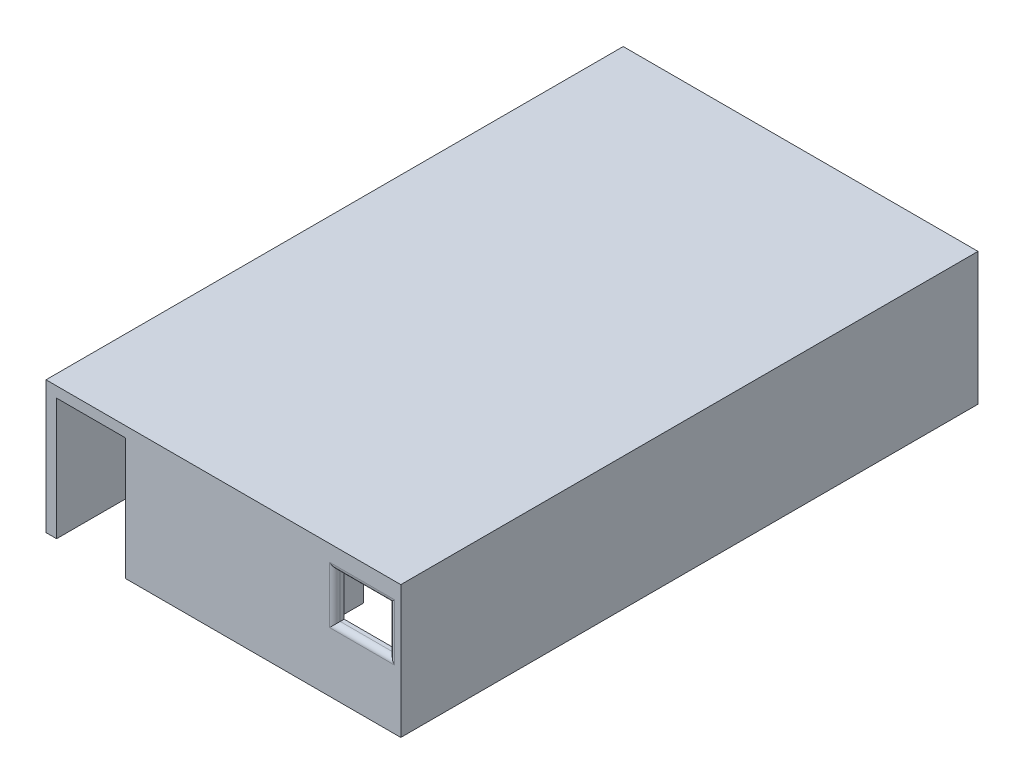
from build123d import *

# Parameters (mm, degrees)
BOSS_EXTRUDE1_DEPTH         = 29
SKETCH3_W                   = 4.5
SKETCH3_H                   = 21
CUT_EXTRUDE1_DEPTH          = 6
SKETCH6_R                   = 2.15
CUT_EXTRUDE2_DEPTH          = 41.509258201
CUT_EXTRUDE3_DEPTH          = 3.5
EXTRUDE_1_REACH             = 41.674
SKETCH_1_W                  = 19.5
SKETCH_1_H                  = 14.5
EXTRUDE_1_DIRECTION_2_REACH = 41.674
SKETCH_2_W                  = 4.5
SKETCH_2_H                  = 1
CUT_EXTRUDE_1_DEPTH         = 19.5
SKETCH_4_W                  = 4
SKETCH_4_H                  = 4
CUT_EXTRUDE_3_DEPTH         = 0.7
SKETCH_5_W                  = 2
SKETCH_5_H                  = 12
CUT_EXTRUDE_4_DEPTH         = 6.25
SKETCH_6_W                  = 11
SKETCH_6_H                  = 11
CUT_EXTRUDE_5_DEPTH         = 6.25
SKETCH_7_W                  = 10.248534494
SKETCH_7_H                  = 8.686096419
CUT_EXTRUDE_6_DEPTH         = 1.75
SKETCH_8_W                  = 2
SKETCH_8_H                  = 14.5
EXTRUDE_2_DEPTH             = 10
SKETCH_9_W                  = 2
SKETCH_9_H                  = 14.5
EXTRUDE_3_DEPTH             = 7.5
FILLET_1_R                  = 1
CUT_EXTRUDE_7_DEPTH         = 41.509258201
CUT_EXTRUDE_7_DEPTH_BACK    = 41.509258201
SKETCH_10_W                 = 65.54105611
SKETCH_10_H                 = 22.030016429
CUT_EXTRUDE_8_DEPTH         = 47.588625221
CUT_EXTRUDE_8_DEPTH_BACK    = 47.588625221
SKETCH_11_W                 = 33.086172565
SKETCH_11_H                 = 28.836254029
SKETCH_12_W                 = 67
SKETCH_12_H                 = 109
EXTRUDE_4_DEPTH             = 2
EXTRUDE_3_2_DEPTH           = 25
SKETCH_13_3_W               = 33
SKETCH_13_3_H               = 2
SKETCH_13_3_W_2             = 2
SKETCH_13_3_H_2             = 94
EXTRUDE_4_2_DEPTH           = 25
EXTRUDE_5_DEPTH             = 10.5
EXTRUDE_5_2_DEPTH           = 2


with BuildPart() as part:
    # Sketch2 → Boss-Extrude1 (new body)
    with BuildSketch(Plane(origin=(0, 0, 0), x_dir=(1, 0, 0), z_dir=(0, 1, 0))):
        with BuildLine():
            Line((0, 10), (0, 20))
            Line((0, 20), (8, 20))
            Line((8, 20), (8, 14.245191882))
            ThreePointArc((8, 14.245191882), (10.672752557, 14.316274399), (13, 13))
            Line((13, 13), (9.464466094, 9.464466094))
            Line((9.464466094, 9.464466094), (2.928932188, 2.928932188))
            ThreePointArc((2.928932188, 2.928932188), (0.761204675, 6.173165676), (0, 10))
        make_face()
    boss_extrude1 = extrude(amount=BOSS_EXTRUDE1_DEPTH)

    # Mirror1: Boss-Extrude1 across plane
    add(boss_extrude1.mirror(Plane(origin=(0, 0, 0), x_dir=(-0.707106781186546, 0, 0.707106781186549), z_dir=(0.707106781186549, 0, 0.707106781186546))))

    # Sketch3 → Cut-Extrude1 (cut)
    with BuildSketch(Plane(origin=(0, 0, -20), x_dir=(-1, 0, 0), z_dir=(0, 0, -1))):
        with Locations((-4, 14.5)):
            Rectangle(SKETCH3_W, SKETCH3_H)
    cut_extrude1 = extrude(amount=-CUT_EXTRUDE1_DEPTH, mode=Mode.SUBTRACT)

    # Mirror2: Cut-Extrude1 across plane
    add(cut_extrude1.mirror(Plane(origin=(0, 0, 0), x_dir=(-0.707106781186546, 0, 0.707106781186549), z_dir=(0.707106781186549, 0, 0.707106781186546))), mode=Mode.SUBTRACT)

    # Sketch6 → Cut-Extrude2 (cut, through all)
    with BuildSketch(Plane(origin=(0, 29, 0), x_dir=(1, 0, 0), z_dir=(0, 1, 0))):
        with Locations(Location((10, 10, 0), (0, 0, 270))):
            Circle(SKETCH6_R)
    extrude(amount=-CUT_EXTRUDE2_DEPTH, mode=Mode.SUBTRACT)

    # Sketch9 → Cut-Extrude3 (cut)
    with BuildSketch(Plane(origin=(0, 24, 0), x_dir=(1, 0, 0), z_dir=(0, 1, 0))):
        Polygon((8.939052358, 13.959510504), (13.429036683, 18.44949483), (18.429313529, 13.762345089), (13.959510504, 8.939052358), (11.060947642, 6.040489496), (7.101437138, 7.101437138), (6.040489496, 11.060947642), align=None)
    cut_extrude3 = extrude(amount=-CUT_EXTRUDE3_DEPTH, mode=Mode.SUBTRACT)

    # Mirror4: Cut-Extrude3 across plane
    add(cut_extrude3.mirror(Plane.ZX.offset(14.5)), mode=Mode.SUBTRACT)


with BuildPart() as body_2:

    # Бобышка-Вытянуть1: up to this face of the body (flat: up to its plane)
    extrude_1_end = Plane(part.part.faces().sort_by_distance((17.122595941, 14.5, -8))[0])
    # Эскиз1 → Бобышка-Вытянуть1 (new, up to the picked face)
    with BuildSketch(Plane(origin=(0, 0, -1.75), x_dir=(-1, 0, 0), z_dir=(0, 0, -1)), mode=Mode.PRIVATE) as extrude_1_sk1:
        with Locations((-29.75, 7.25)):
            Rectangle(SKETCH_1_W, SKETCH_1_H)
    extrude_1_tool1 = split(extrude(extrude_1_sk1.sketch, amount=EXTRUDE_1_REACH, mode=Mode.PRIVATE), bisect_by=extrude_1_end, keep=Keep.BOTH, mode=Mode.PRIVATE)
    add(extrude_1_tool1.solids().sort_by(Axis((29.75, 7.25, -1.75), (0, 0, -1)))[0])


    # Бобышка-Вытянуть1 direction 2: up to this face of the body (flat: up to its plane)
    extrude_1_direction_2_end = Plane(part.part.faces().sort_by_distance((15, 14.5, 0))[0])
    # Эскиз1 → Бобышка-Вытянуть1 direction 2 (add, up to the picked face)
    with BuildSketch(Plane(origin=(0, 0, -1.75), x_dir=(-1, 0, 0), z_dir=(0, 0, -1)), mode=Mode.PRIVATE) as extrude_1_direction_2_sk1:
        with Locations((-29.75, 7.25)):
            Rectangle(SKETCH_1_W, SKETCH_1_H)
    extrude_1_direction_2_tool1 = split(extrude(extrude_1_direction_2_sk1.sketch, amount=-EXTRUDE_1_DIRECTION_2_REACH, mode=Mode.PRIVATE), bisect_by=extrude_1_direction_2_end, keep=Keep.BOTH, mode=Mode.PRIVATE)
    add(extrude_1_direction_2_tool1.solids().sort_by(Axis((29.75, 7.25, -1.75), (0, 0, 1)))[0])

    # Эскиз2 → Вырез-Вытянуть1 (cut)
    with BuildSketch(Plane(origin=(39.5, 0, 0), x_dir=(0, 0, -1), z_dir=(1, 0, 0))):
        with Locations((4, 14)):
            Rectangle(SKETCH_2_W, SKETCH_2_H)
    extrude(amount=-CUT_EXTRUDE_1_DEPTH, mode=Mode.SUBTRACT)

    # Эскиз4 → Вырез-Вытянуть3 (cut)
    with BuildSketch(Plane(origin=(0, 0, -8), x_dir=(-1, 0, 0), z_dir=(0, 0, -1))):
        with Locations((-22.5, 5.912430948)):
            Rectangle(SKETCH_4_W, SKETCH_4_H)
    extrude(amount=-CUT_EXTRUDE_3_DEPTH, mode=Mode.SUBTRACT)

    # Эскиз5 → Вырез-Вытянуть4 (cut)
    with BuildSketch(Plane(origin=(0, 0, -8), x_dir=(-1, 0, 0), z_dir=(0, 0, -1))):
        with Locations((-25.5, 6)):
            Rectangle(SKETCH_5_W, SKETCH_5_H)
    extrude(amount=-CUT_EXTRUDE_4_DEPTH, mode=Mode.SUBTRACT)

    # Эскиз6 → Вырез-Вытянуть5 (cut)
    with BuildSketch(Plane(origin=(0, 0, -8), x_dir=(-1, 0, 0), z_dir=(0, 0, -1))):
        with Locations((-32, 5.5)):
            Rectangle(SKETCH_6_W, SKETCH_6_H)
    extrude(amount=-CUT_EXTRUDE_5_DEPTH, mode=Mode.SUBTRACT)

    # Эскиз7 → Вырез-Вытянуть6 (cut)
    with BuildSketch(Plane(origin=(0, 0, -1.75), x_dir=(-1, 0, 0), z_dir=(0, 0, -1))):
        with Locations((-32.175732753, 6.09304821)):
            Rectangle(SKETCH_7_W, SKETCH_7_H)
    extrude(amount=-CUT_EXTRUDE_6_DEPTH, mode=Mode.SUBTRACT)

    # Эскиз8 → Бобышка-Вытянуть2 (add)
    with BuildSketch(Plane(origin=(0, 0, -8), x_dir=(-1, 0, 0), z_dir=(0, 0, -1))):
        with Locations((-38.5, 7.25)):
            Rectangle(SKETCH_8_W, SKETCH_8_H)
    extrude(amount=EXTRUDE_2_DEPTH)

    # Эскиз9 → Extrude 3 (add)
    with BuildSketch(Plane.ZY.offset(-37.5)):
        with Locations((-17, 7.25)):
            Rectangle(SKETCH_9_W, SKETCH_9_H)
    extrude(amount=EXTRUDE_3_DEPTH)

    # Скругление1
    fillet_1_edges = [body_2.edges().sort_by_distance(p)[0] for p in [
        (32.175732753, 1.75, 0),
        (27.051465506, 6.09304821, 0),
        (32.175732753, 10.436096419, 0),
        (37.3, 6.09304821, 0),
    ]]
    fillet(fillet_1_edges, radius=FILLET_1_R)

    # Эскиз12 → Extrude 4 (add)
    with BuildSketch(Plane(origin=(0, 14.5, 0), x_dir=(1, 0, 0), z_dir=(0, 1, 0))):
        with Locations((6, 54.5)):
            Rectangle(SKETCH_12_W, SKETCH_12_H)
    extrude(amount=-EXTRUDE_4_DEPTH)

    # Эскиз13 → Extrude 3 2 (add)
    with BuildSketch(Plane(origin=(0, 14.5, 0), x_dir=(1, 0, 0), z_dir=(0, 1, 0))):
        Polygon((39.5, 18), (39.5, 109), (-27.5, 109), (-27.5, 107), (37.5, 107), (37.5, 18), align=None)
    extrude(amount=-EXTRUDE_3_2_DEPTH)

    # Эскиз13<3> → Extrude 4 2 (add)
    with BuildSketch(Plane(origin=(0, 14.5, 0), x_dir=(1, 0, 0), z_dir=(0, 1, 0))):
        with Locations((4, 1)):
            Rectangle(SKETCH_13_3_W, SKETCH_13_3_H)
        with Locations((-26.5, 47)):
            Rectangle(SKETCH_13_3_W_2, SKETCH_13_3_H_2)
    extrude(amount=-EXTRUDE_4_2_DEPTH)

    # Эскиз14 → Extrude 5 (add)
    with BuildSketch(Plane.XZ):
        Polygon((20.5, 0), (39.5, 0), (39.5, -18), (37.5, -18), (37.5, -2), (20.5, -2), align=None)
    extrude(amount=EXTRUDE_5_DEPTH)

    # Эскиз15 → Extrude 5 2 (add)
    with BuildSketch(Plane.ZY.offset(27.5)):
        with BuildLine():
            Line((-94, -10.5), (-107, -10.5))
            Line((-107, -10.5), (-107, -3.5))
            ThreePointArc((-107, -3.5), (-100.5, -7.721238279), (-94, -3.5))
            Line((-94, -3.5), (-94, -10.5))
        make_face()
    extrude(amount=-EXTRUDE_5_2_DEPTH)


with BuildPart() as part_1:
    add(part.part)

    # Эскиз10 → Вырез-Вытянуть7 (cut, two sides: drawn at the far end of the back side and taken through both)
    with BuildSketch(Plane(origin=(20, 0, 0), x_dir=(0, 0, -1), z_dir=(1, 0, 0)).offset(-CUT_EXTRUDE_7_DEPTH_BACK)):
        with Locations((-4.725182995, 25.515008214)):
            Rectangle(SKETCH_10_W, SKETCH_10_H)
    extrude(amount=CUT_EXTRUDE_7_DEPTH + CUT_EXTRUDE_7_DEPTH_BACK, mode=Mode.SUBTRACT)

    # Эскиз11 → Вырез-Вытянуть8 (cut, two sides: drawn at the far end of the back side and taken through both)
    with BuildSketch(Plane(origin=(0, 14.5, 0), x_dir=(1, 0, 0), z_dir=(0, 1, 0)).offset(-CUT_EXTRUDE_8_DEPTH_BACK)):
        with Locations((3.456913717, 14.418127015)):
            Rectangle(SKETCH_11_W, SKETCH_11_H)
    extrude(amount=CUT_EXTRUDE_8_DEPTH + CUT_EXTRUDE_8_DEPTH_BACK, mode=Mode.SUBTRACT)


solid = body_2.part
